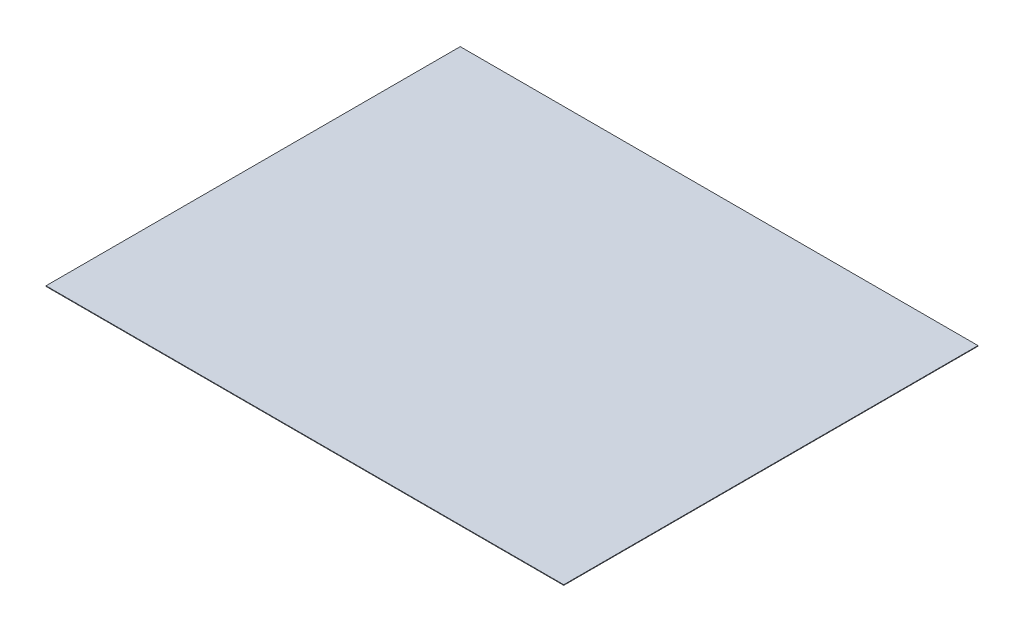
from build123d import *

# Parameters (mm, degrees)
SKETCH1_W           = 9144
SKETCH1_H           = 7315.2
BOSS_EXTRUDE1_DEPTH = 10


with BuildPart() as part:
    # Sketch1 → Boss-Extrude1 (new body)
    with BuildSketch(Plane(origin=(0, 0, 0), x_dir=(1, 0, 0), z_dir=(0, 1, 0))):
        Rectangle(SKETCH1_W, SKETCH1_H)
    extrude(amount=BOSS_EXTRUDE1_DEPTH)


solid = part.part
